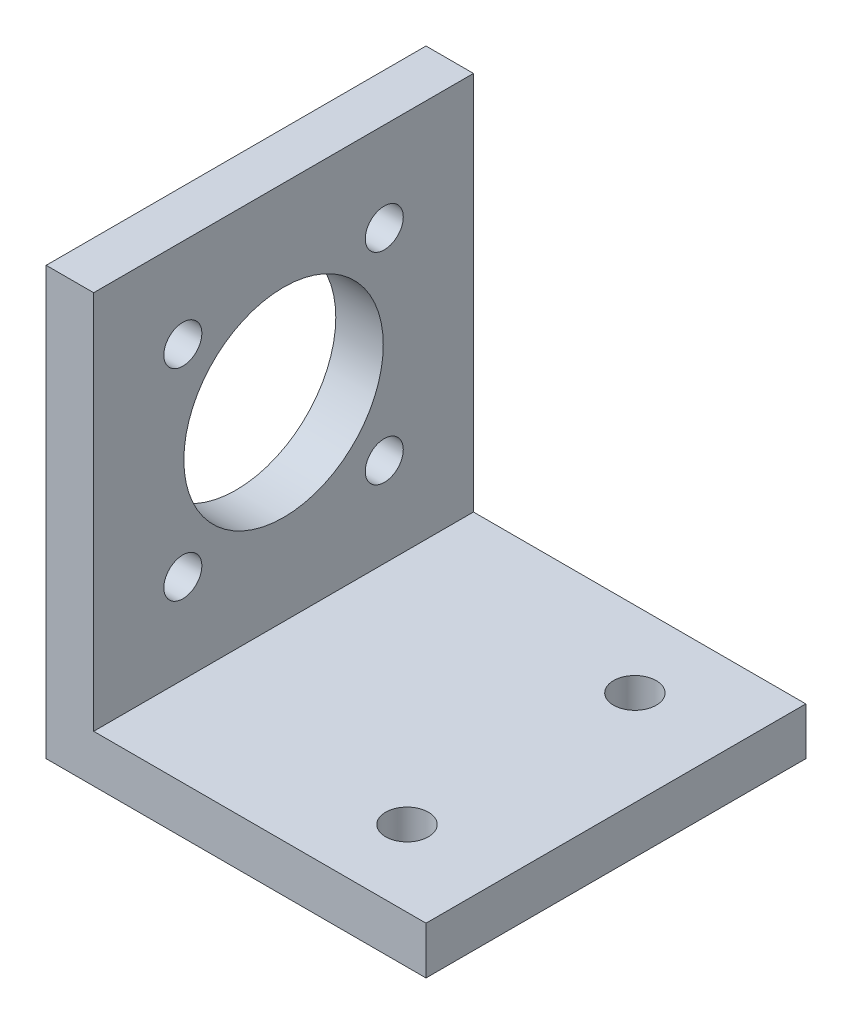
from build123d import *

# Parameters (mm, degrees)
SKETCH1_W           = 40
SKETCH1_H           = 40
BOSS_EXTRUDE1_DEPTH = 5
SKETCH3_W           = 5
SKETCH3_H           = 40
BOSS_EXTRUDE6_DEPTH = 40
SKETCH4_R           = 2.25
CUT_EXTRUDE2_DEPTH  = 49.989794856
SKETCH5_R           = 10.5
SKETCH5_R_2         = 2
CUT_EXTRUDE3_DEPTH  = 61.415229868


with BuildPart() as part:
    # Sketch1 → Boss-Extrude1 (new body)
    with BuildSketch(Plane(origin=(0, 0, 0), x_dir=(1, 0, 0), z_dir=(0, 1, 0))):
        Rectangle(SKETCH1_W, SKETCH1_H)
    extrude(amount=BOSS_EXTRUDE1_DEPTH)

    # Sketch3 → Boss-Extrude6 (add)
    with BuildSketch(Plane(origin=(0, 5, 0), x_dir=(1, 0, 0), z_dir=(0, 1, 0))):
        with Locations((-17.5, 0)):
            Rectangle(SKETCH3_W, SKETCH3_H)
    extrude(amount=BOSS_EXTRUDE6_DEPTH)

    # Sketch4 → Cut-Extrude2 (cut, through all)
    with BuildSketch(Plane(origin=(0, 5, 0), x_dir=(1, 0, 0), z_dir=(0, 1, 0))):
        with Locations(Location((10, 12, 0), (0, 0, 270))):
            Circle(SKETCH4_R)
        with Locations(Location((10, -12, 0), (0, 0, 90))):
            Circle(SKETCH4_R)
    extrude(amount=-CUT_EXTRUDE2_DEPTH, mode=Mode.SUBTRACT)

    # Sketch5 → Cut-Extrude3 (cut, through all)
    with BuildSketch(Plane(origin=(-15, 0, 0), x_dir=(0, 0, -1), z_dir=(1, 0, 0))):
        with Locations((0, 25)):
            Circle(SKETCH5_R)
        with Locations((-10.606601718, 35.606601718)):
            Circle(SKETCH5_R_2)
        with Locations((10.606601718, 35.606601718)):
            Circle(SKETCH5_R_2)
        with Locations((10.606601718, 14.393398282)):
            Circle(SKETCH5_R_2)
        with Locations((-10.606601718, 14.393398282)):
            Circle(SKETCH5_R_2)
    extrude(amount=-CUT_EXTRUDE3_DEPTH, mode=Mode.SUBTRACT)


solid = part.part
